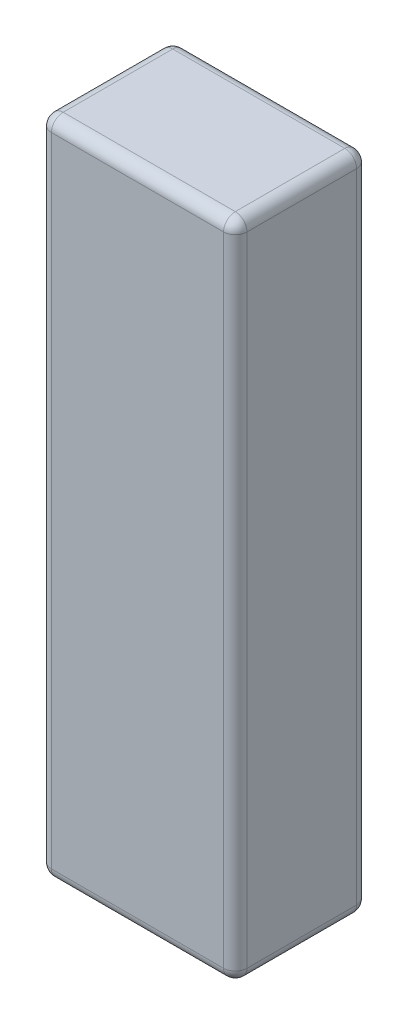
from build123d import *

# Parameters (mm, degrees)
SKETCH1_W           = 50
SKETCH1_H           = 169
BOSS_EXTRUDE1_DEPTH = 17
FILLET1_R           = 3


with BuildPart() as part:
    # Sketch1 → Boss-Extrude1 (new, symmetric)
    with BuildSketch(Plane.XY):
        Rectangle(SKETCH1_W, SKETCH1_H)
    extrude(amount=BOSS_EXTRUDE1_DEPTH, both=True)

    # Fillet1
    fillet1_edges = [part.edges().sort_by_distance(p)[0] for p in [
        (-25, 0, 17),
        (0, -84.5, 17),
        (25, 0, 17),
        (0, -84.5, -17),
        (-25, 0, -17),
        (0, 84.5, -17),
        (25, 0, -17),
        (0, 84.5, 17),
        (25, -84.5, 0),
        (-25, -84.5, 0),
        (-25, 84.5, 0),
        (25, 84.5, 0),
    ]]
    fillet(fillet1_edges, radius=FILLET1_R)


solid = part.part
